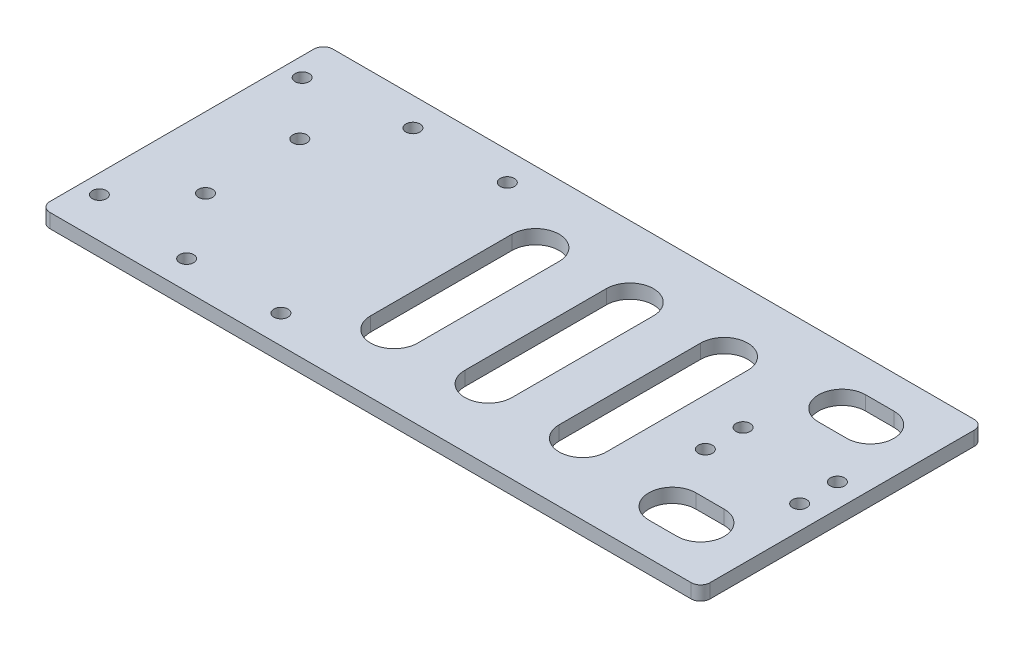
from build123d import *

# Parameters (mm, degrees)
SKETCH_1_R          = 1.5
EXTRUDE_1_DEPTH     = 3
SKETCH_3_R          = 1.5
CUT_EXTRUDE_1_DEPTH = 81.833161512
CUT_EXTRUDE_2_DEPTH = 81.833161512
FILLET_1_R          = 2


with BuildPart() as part:
    # 草图1 → 凸台-拉伸1 (new body)
    with BuildSketch(Plane(origin=(0, 0, 0), x_dir=(1, 0, 0), z_dir=(0, 1, 0))):
        Polygon((-65, 30), (65, 30), (65, -30), (-65, -30), (-75, -30), (-75, 30), align=None)
        with Locations(Location((-60, 10, 0), (0, 0, 270))):
            Circle(SKETCH_1_R, mode=Mode.SUBTRACT)
        with Locations(Location((-60, -10, 0), (0, 0, 270))):
            Circle(SKETCH_1_R, mode=Mode.SUBTRACT)
        with Locations(Location((-50, -24, 0), (0, 0, 270))):
            Circle(SKETCH_1_R, mode=Mode.SUBTRACT)
        with Locations(Location((-30, -24, 0), (0, 0, 270))):
            Circle(SKETCH_1_R, mode=Mode.SUBTRACT)
        with Locations(Location((-30, 24, 0), (0, 0, 90))):
            Circle(SKETCH_1_R, mode=Mode.SUBTRACT)
        with Locations(Location((-50, 24, 0), (0, 0, 90))):
            Circle(SKETCH_1_R, mode=Mode.SUBTRACT)
        with Locations(Location((-71, 21.5, 0), (0, 0, 270))):
            Circle(SKETCH_1_R, mode=Mode.SUBTRACT)
        with Locations(Location((-71, -21.5, 0), (0, 0, 270))):
            Circle(SKETCH_1_R, mode=Mode.SUBTRACT)
    extrude(amount=EXTRUDE_1_DEPTH)

    # 草图3 → 切除-拉伸1 (cut, through all)
    with BuildSketch(Plane.XZ):
        with Locations(Location((40, 4, 0), (0, 0, 270))):
            Circle(SKETCH_3_R)
        with Locations(Location((60, 4, 0), (0, 0, 270))):
            Circle(SKETCH_3_R)
        with Locations(Location((60, -4, 0), (0, 0, 90))):
            Circle(SKETCH_3_R)
        with Locations(Location((40, -4, 0), (0, 0, 90))):
            Circle(SKETCH_3_R)
    extrude(amount=-CUT_EXTRUDE_1_DEPTH, mode=Mode.SUBTRACT)

    # 草图4 → 切除-拉伸2 (cut, through all)
    with BuildSketch(Plane(origin=(0, 3, 0), x_dir=(1, 0, 0), z_dir=(0, 1, 0))):
        with BuildLine():
            Line((-10, 15), (-10, -15))
            ThreePointArc((-10, -15), (-15, -20), (-20, -15))
            Line((-20, -15), (-20, 15))
            ThreePointArc((-20, 15), (-15, 20), (-10, 15))
        make_face()
        with BuildLine():
            Line((10, 15), (10, -15))
            ThreePointArc((10, -15), (5, -20), (0, -15))
            Line((0, -15), (0, 15))
            ThreePointArc((0, 15), (5, 20), (10, 15))
        make_face()
        with BuildLine():
            Line((30, 15), (30, -15))
            ThreePointArc((30, -15), (25, -20), (20, -15))
            Line((20, -15), (20, 15))
            ThreePointArc((20, 15), (25, 20), (30, 15))
        make_face()
        with BuildLine():
            Line((47, 23), (53, 23))
            ThreePointArc((53, 23), (58, 18), (53, 13))
            Line((53, 13), (47, 13))
            ThreePointArc((47, 13), (42, 18), (47, 23))
        make_face()
        with BuildLine():
            Line((47, -23), (53, -23))
            ThreePointArc((53, -23), (58, -18), (53, -13))
            Line((53, -13), (47, -13))
            ThreePointArc((47, -13), (42, -18), (47, -23))
        make_face()
    extrude(amount=-CUT_EXTRUDE_2_DEPTH, mode=Mode.SUBTRACT)

    # 圆角1
    fillet_1_edges = [part.edges().sort_by_distance(p)[0] for p in [
        (65, 1.5, 30),
        (-75, 1.5, 30),
        (-75, 1.5, -30),
        (65, 1.5, -30),
    ]]
    fillet(fillet_1_edges, radius=FILLET_1_R)


solid = part.part
